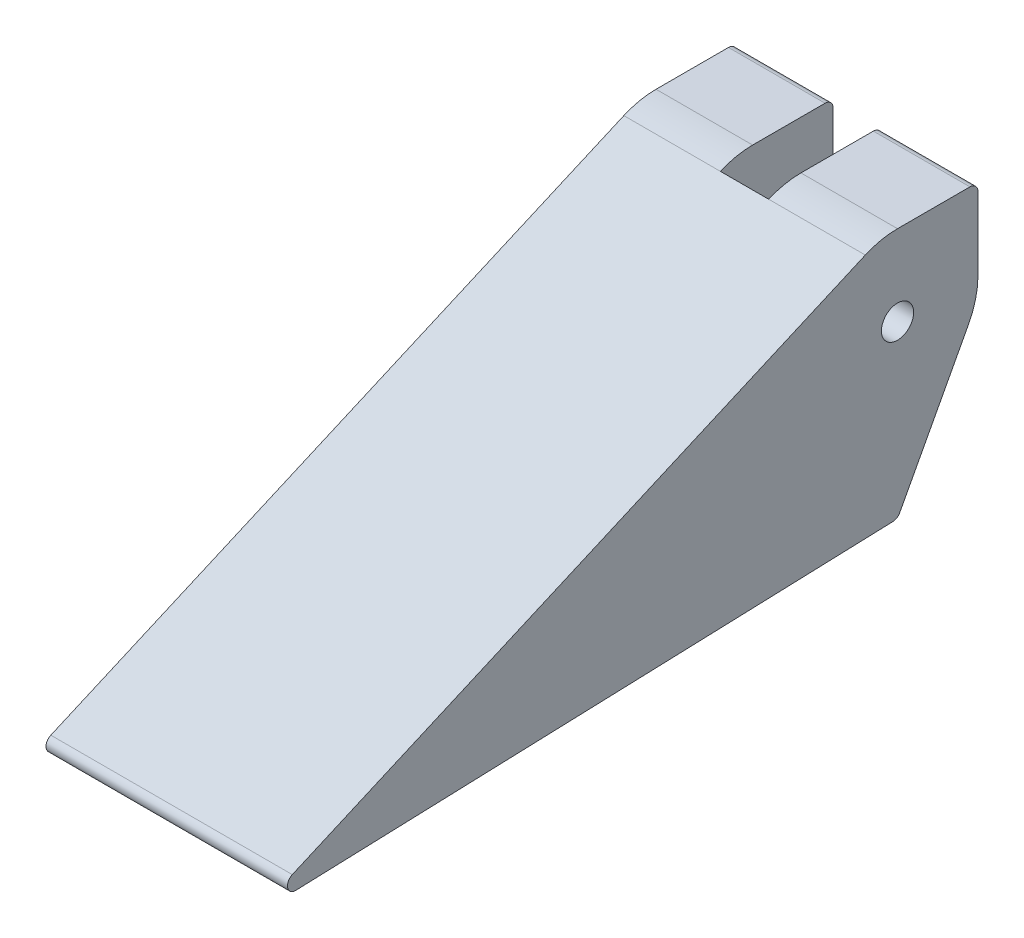
from build123d import *

# Parameters (mm, degrees)
SKETCH1_R               = 2.54
BOSS_EXTRUDE1_DEPTH     = 38.1
CUT_EXTRUDE1_DEPTH      = 3.81
CUT_EXTRUDE1_DEPTH_BACK = 3.81
SKETCH4_R               = 5.08


with BuildPart() as part:
    # Sketch1 → Boss-Extrude1 (new body)
    with BuildSketch(Plane(origin=(0, 0, 0), x_dir=(0, 0, -1), z_dir=(1, 0, 0))):
        with BuildLine():
            Line((11.199311053, -5.988775495), (0.344819113, -26.287220755))
            ThreePointArc((0.344819113, -26.287220755), (-0.103387784, -26.766158861), (-0.730789632, -26.957569556))
            Line((-0.730789632, -26.957569556), (-94.938797587, -30.247385686))
            ThreePointArc((-94.938797587, -30.247385686), (-96.22161935, -29.25926293), (-95.4910689, -27.814162831))
            Line((-95.4910689, -27.814162831), (-5.079489514, 11.639965046))
            ThreePointArc((-5.079489514, 11.639965046), (-2.594459858, 12.432167069), (0, 12.7))
            Line((0, 12.7), (11.43, 12.7))
            ThreePointArc((11.43, 12.7), (12.328025612, 12.328025612), (12.7, 11.43))
            Line((12.7, 11.43), (12.7, 0))
            ThreePointArc((12.7, 0), (12.31911625, -3.086968547), (11.199311053, -5.988775495))
        make_face()
        with Locations(Location((0, 0, 0), (0, 0, 180))):
            Circle(SKETCH1_R, mode=Mode.SUBTRACT)
    extrude(amount=BOSS_EXTRUDE1_DEPTH)

    # Sketch4 → Cut-Extrude1 (cut, two sides: drawn at the far end of the back side and taken through both)
    with BuildSketch(Plane(origin=(19.05, 0, 0), x_dir=(0, 0, -1), z_dir=(1, 0, 0)).offset(-CUT_EXTRUDE1_DEPTH_BACK)):
        with BuildLine():
            Line((-5.08, 25.792214679), (-5.08, 0))
            ThreePointArc((-5.08, 0), (0, 5.08), (5.08, 0))
            ThreePointArc((5.08, 0), (1.314800749, -4.906903198), (-4.399409051, -2.54))
            Line((-4.399409051, -2.54), (14.172067989, -34.706741806))
            Line((14.172067989, -34.706741806), (14.172067989, 25.792214679))
            Line((14.172067989, 25.792214679), (-5.08, 25.792214679))
        make_face()
        Circle(SKETCH4_R)
    extrude(amount=CUT_EXTRUDE1_DEPTH + CUT_EXTRUDE1_DEPTH_BACK, mode=Mode.SUBTRACT)


solid = part.part
